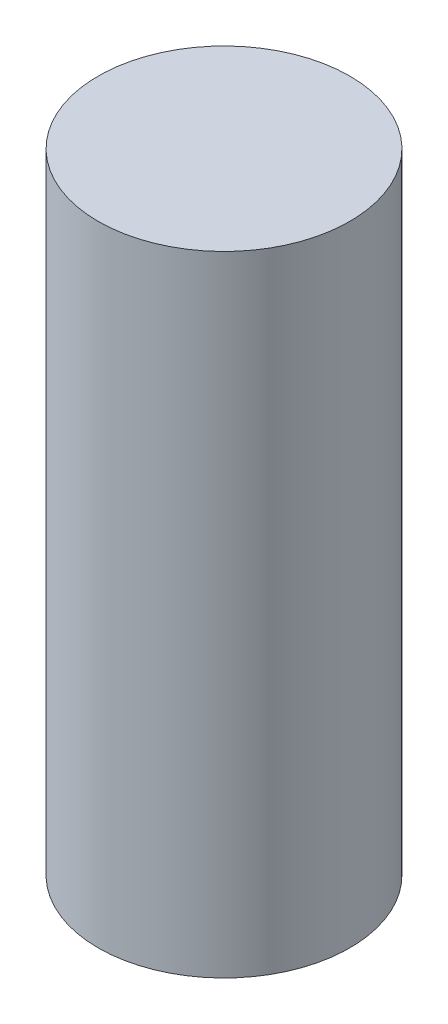
from build123d import *

# Parameters (mm, degrees)
SKETCH1_R           = 40
BOSS_EXTRUDE1_DEPTH = 200


with BuildPart() as part:
    # Sketch1 → Boss-Extrude1 (new body)
    with BuildSketch(Plane(origin=(0, 0, 0), x_dir=(1, 0, 0), z_dir=(0, 1, 0))):
        with Locations(Location((0, 0, 0), (0, 0, 270))):
            Circle(SKETCH1_R)
    extrude(amount=BOSS_EXTRUDE1_DEPTH)


solid = part.part
